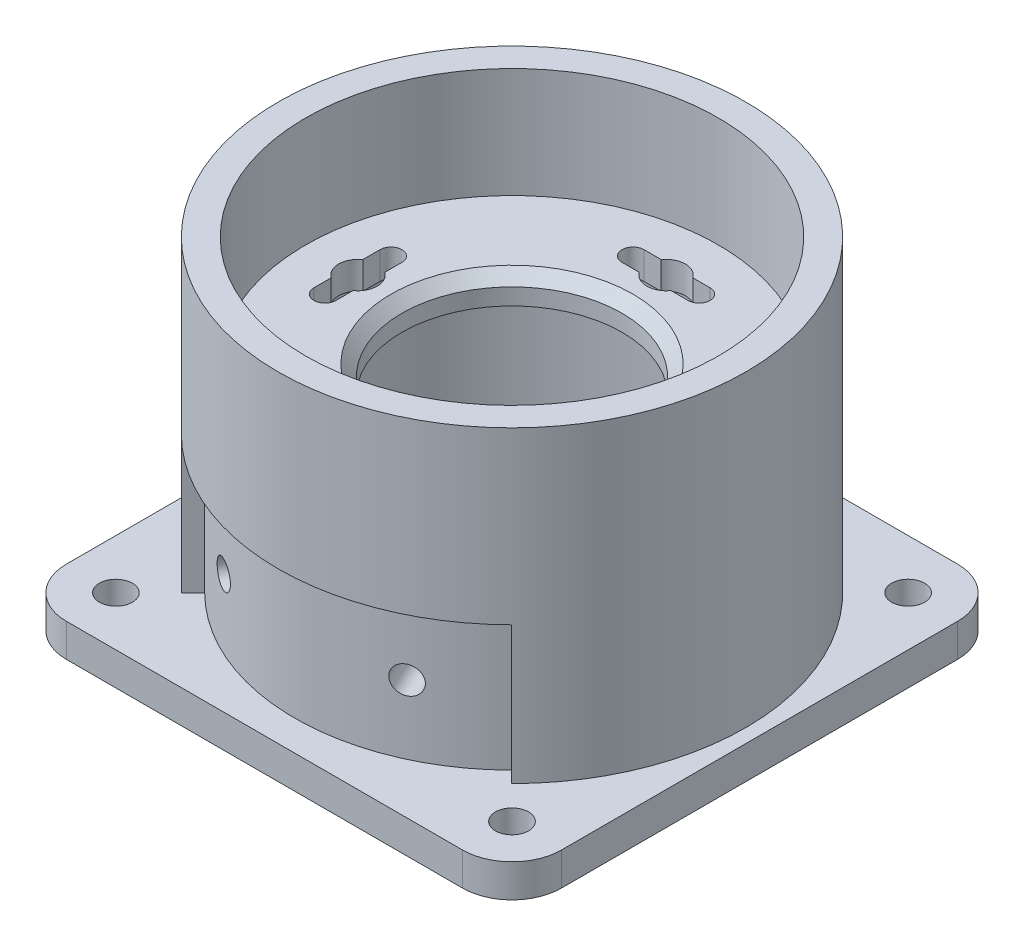
from build123d import *

# Parameters (mm, degrees)
SKETCH_1_R          = 42.5
SKETCH_1_R_2        = 3
EXTRUDE_1_DEPTH     = 6
SKETCH_1_3_R        = 42.5
SKETCH_1_3_R_2      = 37.5
EXTRUDE_2_DEPTH     = 62
EXTRUDE_START       = 37
SKETCH_1_5_R        = 37.5
SKETCH_1_5_R_2      = 20
EXTRUDE_3_DEPTH     = 5
CHAMFER_1_SIZE      = 2
EXTRUDE_4_DEPTH     = 37
CUT_EXTRUDE_2_DEPTH = 25
CUT_EXTRUDE_3_REACH = 78.25


with BuildPart() as part:
    # 草图1 → 凸台-拉伸1 (new body)
    with BuildSketch(Plane(origin=(0, 0, 0), x_dir=(1, 0, 0), z_dir=(0, 1, 0))):
        with BuildLine():
            Line((-36, 45), (36, 45))
            ThreePointArc((36, 45), (42.363961031, 42.363961031), (45, 36))
            Line((45, 36), (45, -36))
            ThreePointArc((45, -36), (42.363961031, -42.363961031), (36, -45))
            Line((36, -45), (-36, -45))
            ThreePointArc((-36, -45), (-42.363961031, -42.363961031), (-45, -36))
            Line((-45, -36), (-45, 36))
            ThreePointArc((-45, 36), (-42.363961031, 42.363961031), (-36, 45))
        make_face()
        with Locations(Location((0, 0, 0), (0, 0, 270))):
            Circle(SKETCH_1_R, mode=Mode.SUBTRACT)
        with Locations(Location((-36, 36, 0), (0, 0, 270))):
            Circle(SKETCH_1_R_2, mode=Mode.SUBTRACT)
        with Locations(Location((36, 36, 0), (0, 0, 270))):
            Circle(SKETCH_1_R_2, mode=Mode.SUBTRACT)
        with Locations(Location((36, -36, 0), (0, 0, 270))):
            Circle(SKETCH_1_R_2, mode=Mode.SUBTRACT)
        with Locations(Location((-36, -36, 0), (0, 0, 270))):
            Circle(SKETCH_1_R_2, mode=Mode.SUBTRACT)
    extrude(amount=EXTRUDE_1_DEPTH)

    # 草图1<3> → 凸台-拉伸2 (add)
    with BuildSketch(Plane(origin=(0, 0, 0), x_dir=(1, 0, 0), z_dir=(0, 1, 0))):
        with Locations(Location((0, 0, 0), (0, 0, 270))):
            Circle(SKETCH_1_3_R)
        with Locations(Location((0, 0, 0), (0, 0, 270))):
            Circle(SKETCH_1_3_R_2, mode=Mode.SUBTRACT)
    extrude(amount=EXTRUDE_2_DEPTH)

    # 草图1<5> → 凸台-拉伸3 (add)
    with BuildSketch(Plane(origin=(0, 0, 0), x_dir=(1, 0, 0), z_dir=(0, 1, 0)).offset(EXTRUDE_START)):
        with Locations(Location((0, 0, 0), (0, 0, 270))):
            Circle(SKETCH_1_5_R)
        with Locations(Location((0, 0, 0), (0, 0, 270))):
            Circle(SKETCH_1_5_R_2, mode=Mode.SUBTRACT)
    extrude(amount=EXTRUDE_3_DEPTH)

    # 倒角1
    chamfer_1_edges = [part.edges().sort_by_distance(p)[0] for p in [
        (0, 42, -20),
    ]]
    chamfer(chamfer_1_edges, length=CHAMFER_1_SIZE)

    # 草图1<6> → 凸台-拉伸4 (add)
    with BuildSketch(Plane(origin=(0, 0, 0), x_dir=(1, 0, 0), z_dir=(0, 1, 0))):
        with BuildLine():
            Line((27.950849719, -25), (-27.950849719, -25))
            ThreePointArc((-27.950849719, -25), (0, -37.5), (27.950849719, -25))
        make_face()
    extrude(amount=EXTRUDE_4_DEPTH)

    # 草图2 → 切除-拉伸2 (cut)
    with BuildSketch(Plane(origin=(0, 6, 0), x_dir=(1, 0, 0), z_dir=(0, 1, 0))):
        with BuildLine():
            Line((-27.882352941, -27.978999168), (-30, -30.103986447))
            ThreePointArc((-30, -30.103986447), (0, -42.5), (30, -30.103986447))
            Line((30, -30.103986447), (27.882352941, -27.978999168))
            ThreePointArc((27.882352941, -27.978999168), (0, -39.5), (-27.882352941, -27.978999168))
        make_face()
    extrude(amount=CUT_EXTRUDE_2_DEPTH, mode=Mode.SUBTRACT)

    # 草图3 → 切除-旋转1 (revolve, cut)
    with BuildSketch(Plane(origin=(0, 18.5, 0), x_dir=(1, 0, 0), z_dir=(0, 1, 0))):
        Polygon((11.657691454, -25), (17.095538176, -22.46429043), (18.961631098, -26.466139615), (15.789553843, -27.945303531), (20.195943791, -37.394837269), (17.930174324, -38.451382923), align=None)
    revolve(axis=Axis((17.930174324, 18.5, 38.451382923), (-0.42261826174070033, 0, -0.9063077870366495)), mode=Mode.SUBTRACT)

    # 草图3<4> → 切除-旋转2 (revolve, cut)
    with BuildSketch(Plane(origin=(0, 18.5, 0), x_dir=(1, 0, 0), z_dir=(0, 1, 0)), mode=Mode.PRIVATE) as cut_revolve_2_sk:
        Polygon((-20.195943791, -37.394837269), (-17.930174324, -38.451382923), (-11.657691454, -25), (-17.095538176, -22.46429043), (-18.961631098, -26.466139615), (-15.789553843, -27.945303531), align=None)
    revolve(cut_revolve_2_sk.sketch.rotate(Axis((-17.930174324, 18.5, 38.451382923), (0.42261826174069994, 0, -0.9063077870366497)), 180), axis=Axis((-17.930174324, 18.5, 38.451382923), (0.42261826174069994, 0, -0.9063077870366497)), mode=Mode.SUBTRACT)

    # 草图5 → 切除-拉伸3 (cut, up to next)
    with BuildSketch(Plane(origin=(0, 42, 0), x_dir=(1, 0, 0), z_dir=(0, 1, 0)), mode=Mode.PRIVATE) as cut_extrude_3_sk1:
        with BuildLine():
            Line((-6, 30), (-2.872281323, 30))
            ThreePointArc((-2.872281323, 30), (0, 31.5), (2.872281323, 30))
            Line((2.872281323, 30), (6, 30))
            ThreePointArc((6, 30), (8, 28), (6, 26))
            Line((6, 26), (2.872281323, 26))
            ThreePointArc((2.872281323, 26), (0, 24.5), (-2.872281323, 26))
            Line((-2.872281323, 26), (-6, 26))
            ThreePointArc((-6, 26), (-8, 28), (-6, 30))
        make_face()
    cut_extrude_3_tool1 = extrude(cut_extrude_3_sk1.sketch, amount=-CUT_EXTRUDE_3_REACH, mode=Mode.PRIVATE) & part.part
    # 草图5 → 切除-拉伸3 (cut, up to next)
    with BuildSketch(Plane(origin=(0, 42, 0), x_dir=(1, 0, 0), z_dir=(0, 1, 0)), mode=Mode.PRIVATE) as cut_extrude_3_sk2:
        with BuildLine():
            Line((26, 6), (26, 2.872281323))
            ThreePointArc((26, 2.872281323), (24.5, 0), (26, -2.872281323))
            Line((26, -2.872281323), (26, -6))
            ThreePointArc((26, -6), (28, -8), (30, -6))
            Line((30, -6), (30, -2.872281323))
            ThreePointArc((30, -2.872281323), (31.5, 0), (30, 2.872281323))
            Line((30, 2.872281323), (30, 6))
            ThreePointArc((30, 6), (28, 8), (26, 6))
        make_face()
    cut_extrude_3_tool2 = extrude(cut_extrude_3_sk2.sketch, amount=-CUT_EXTRUDE_3_REACH, mode=Mode.PRIVATE) & part.part
    # 草图5 → 切除-拉伸3 (cut, up to next)
    with BuildSketch(Plane(origin=(0, 42, 0), x_dir=(1, 0, 0), z_dir=(0, 1, 0)), mode=Mode.PRIVATE) as cut_extrude_3_sk3:
        with BuildLine():
            Line((-26, -6), (-26, -2.872281323))
            ThreePointArc((-26, -2.872281323), (-24.5, 0), (-26, 2.872281323))
            Line((-26, 2.872281323), (-26, 6))
            ThreePointArc((-26, 6), (-28, 8), (-30, 6))
            Line((-30, 6), (-30, 2.872281323))
            ThreePointArc((-30, 2.872281323), (-31.5, 0), (-30, -2.872281323))
            Line((-30, -2.872281323), (-30, -6))
            ThreePointArc((-30, -6), (-28, -8), (-26, -6))
        make_face()
    cut_extrude_3_tool3 = extrude(cut_extrude_3_sk3.sketch, amount=-CUT_EXTRUDE_3_REACH, mode=Mode.PRIVATE) & part.part
    add(cut_extrude_3_tool1.solids().sort_by_distance((0, 42, -28))[0], mode=Mode.SUBTRACT)
    add(cut_extrude_3_tool2.solids().sort_by_distance((28, 42, 0))[0], mode=Mode.SUBTRACT)
    add(cut_extrude_3_tool3.solids().sort_by_distance((-28, 42, 0))[0], mode=Mode.SUBTRACT)


solid = part.part
